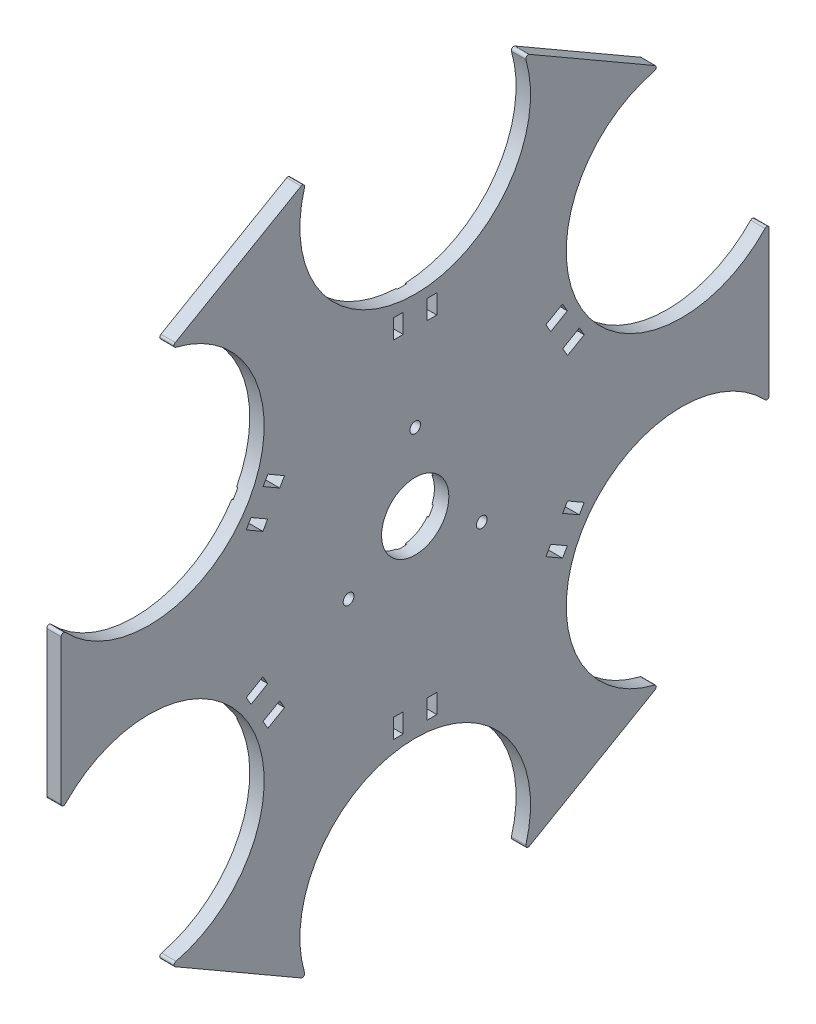
from build123d import *

# Parameters (mm, degrees)
SKETCH2_R                       = 11.10996
BOSS_EXTRUDE1_DEPTH             = 4.7625
SKETCH3_W                       = 3.175
SKETCH3_H                       = 181.991160274
CUT_EXTRUDE1_DEPTH              = 0.396875
FILLET1_R                       = 0.79375
F_9_64_0_14063_DIAMETER_HOLE1_D = 3.572002
SKETCH8_W                       = 3.175
SKETCH8_H                       = 6.35
CUT_EXTRUDE2_DEPTH              = 163.951186269


with BuildPart() as part:
    # Sketch2 → Boss-Extrude1 (new body)
    with BuildSketch(Plane(origin=(0, 0, 0), x_dir=(0, 0, -1), z_dir=(1, 0, 0))):
        with BuildLine():
            Line((81.02619141, 88.258519733), (35.921024484, 114.3))
            ThreePointArc((35.921024484, 114.3), (0, 63.5), (-35.921024484, 114.3))
            Line((-35.921024484, 114.3), (-81.02619141, 88.258519733))
            ThreePointArc((-81.02619141, 88.258519733), (-54.99261314, 31.75), (-116.947215895, 26.041480267))
            Line((-116.947215895, 26.041480267), (-116.947215895, -26.041480267))
            ThreePointArc((-116.947215895, -26.041480267), (-54.99261314, -31.75), (-81.02619141, -88.258519733))
            Line((-81.02619141, -88.258519733), (-35.921024484, -114.3))
            ThreePointArc((-35.921024484, -114.3), (0, -63.5), (35.921024484, -114.3))
            Line((35.921024484, -114.3), (81.02619141, -88.258519733))
            ThreePointArc((81.02619141, -88.258519733), (54.99261314, -31.75), (116.947215895, -26.041480267))
            Line((116.947215895, -26.041480267), (116.947215895, 26.041480267))
            ThreePointArc((116.947215895, 26.041480267), (54.99261314, 31.75), (81.02619141, 88.258519733))
        make_face()
        with Locations(Location((0, 0, 0), (0, 0, 180))):
            Circle(SKETCH2_R, mode=Mode.SUBTRACT)
    extrude(amount=BOSS_EXTRUDE1_DEPTH)

    # Sketch3 → Cut-Extrude1 (cut)
    with BuildSketch(Plane.ZY):
        with Locations((0, 101.6)):
            Rectangle(SKETCH3_W, SKETCH3_H)
        Polygon((167.586415056, 94.92297474), (165.998915056, 97.672605397), (8.389946993, 6.67702526), (9.977446993, 3.927394603), align=None)
        Polygon((165.998915056, -97.672605397), (167.586415056, -94.92297474), (9.977446993, -3.927394603), (8.389946993, -6.67702526), align=None)
        with Locations((0, -101.6)):
            Rectangle(SKETCH3_W, SKETCH3_H)
        Polygon((-167.586415056, -94.92297474), (-165.998915056, -97.672605397), (-8.389946993, -6.67702526), (-9.977446993, -3.927394603), align=None)
        Polygon((-165.998915056, 97.672605397), (-167.586415056, 94.92297474), (-9.977446993, 3.927394603), (-8.389946993, 6.67702526), align=None)
    extrude(amount=-CUT_EXTRUDE1_DEPTH, mode=Mode.SUBTRACT)

    # Fillet1
    fillet1_edges = [part.edges().sort_by_distance(p)[0] for p in [
        (2.38125, 88.258519733, 81.02619141),
        (2.38125, 114.3, 35.921024484),
        (2.38125, 114.3, -35.921024484),
        (2.38125, 88.258519733, -81.02619141),
        (2.38125, 26.041480267, -116.947215895),
        (2.38125, -26.041480267, -116.947215895),
        (2.38125, -88.258519733, -81.02619141),
        (2.38125, -114.3, -35.921024484),
        (2.38125, -114.3, 35.921024484),
        (2.38125, -88.258519733, 81.02619141),
        (2.38125, -26.041480267, 116.947215895),
        (2.38125, 26.041480267, 116.947215895),
    ]]
    fillet(fillet1_edges, radius=FILLET1_R)

    # 9/64 (0.14063) Diameter Hole1 (through all)
    with Locations(Plane.ZY):
        with Locations((0, 25.4), (21.997045256, -12.7), (-21.997045256, -12.7)):
            Hole(F_9_64_0_14063_DIAMETER_HOLE1_D / 2)

    # Sketch8 → Cut-Extrude2 (cut, through all)
    with BuildSketch(Plane.ZY):
        with Locations((5.55625, 57.15)):
            Rectangle(SKETCH8_W, SKETCH8_H)
        with Locations((-5.55625, 57.15)):
            Rectangle(SKETCH8_W, SKETCH8_H)
        Polygon((44.759346169, 30.424538321), (43.171846169, 33.174168978), (48.671107483, 36.349168978), (50.258607483, 33.599538321), align=None)
        Polygon((54.227357483, 26.725461679), (55.814857483, 23.975831022), (50.315596169, 20.800831022), (48.728096169, 23.550461679), align=None)
        Polygon((48.728096169, -23.550461679), (50.315596169, -20.800831022), (55.814857483, -23.975831022), (54.227357483, -26.725461679), align=None)
        Polygon((50.258607483, -33.599538321), (48.671107483, -36.349168978), (43.171846169, -33.174168978), (44.759346169, -30.424538321), align=None)
        with Locations((5.55625, -57.15)):
            Rectangle(SKETCH8_W, SKETCH8_H)
        with Locations((-5.55625, -57.15)):
            Rectangle(SKETCH8_W, SKETCH8_H)
        Polygon((-44.759346169, -30.424538321), (-43.171846169, -33.174168978), (-48.671107483, -36.349168978), (-50.258607483, -33.599538321), align=None)
        Polygon((-54.227357483, -26.725461679), (-55.814857483, -23.975831022), (-50.315596169, -20.800831022), (-48.728096169, -23.550461679), align=None)
        Polygon((-48.728096169, 23.550461679), (-50.315596169, 20.800831022), (-55.814857483, 23.975831022), (-54.227357483, 26.725461679), align=None)
        Polygon((-50.258607483, 33.599538321), (-48.671107483, 36.349168978), (-43.171846169, 33.174168978), (-44.759346169, 30.424538321), align=None)
    extrude(amount=-CUT_EXTRUDE2_DEPTH, mode=Mode.SUBTRACT)


solid = part.part
